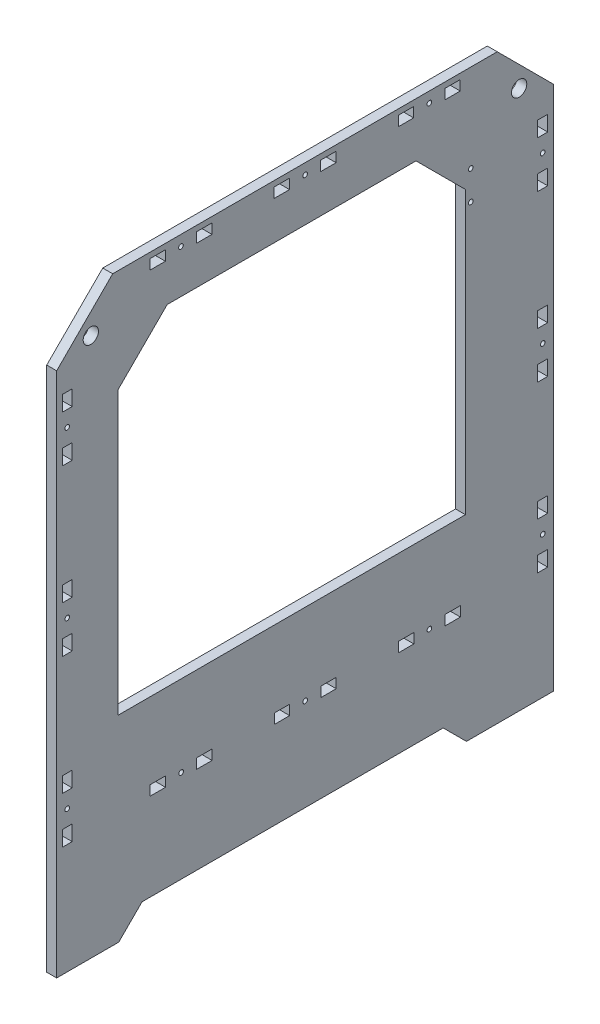
from build123d import *

# Parameters (mm, degrees)
SKETCH1_R           = 1.5
SKETCH1_R_2         = 4.925
SKETCH1_W           = 9.9
SKETCH1_H           = 6.4
SKETCH1_W_2         = 6.4
SKETCH1_H_2         = 9.4
BOSS_EXTRUDE1_DEPTH = 6.4
SKETCH2_R           = 1.5
SKETCH2_W           = 6.4
SKETCH2_H           = 9.9
CUT_EXTRUDE1_DEPTH  = 415.760486883


with BuildPart() as part:
    # Sketch1 → Boss-Extrude1 (new body)
    with BuildSketch(Plane(origin=(0, 0, 0), x_dir=(0, 0, -1), z_dir=(1, 0, 0))):
        Polygon((210.165001125, 41.275232149), (-37.634998875, 41.275232149), (-73.734998875, 5.175232149), (-73.734998875, -333.674767851), (-33.721689147, -333.674767851), (-18.721689147, -318.674767851), (175.325001125, -318.674767851), (190.325001125, -333.674767851), (246.265001125, -333.674767851), (246.265001125, 5.175232149), align=None)
        with Locations((6.365001125, 34.475232149)):
            Circle(SKETCH1_R, mode=Mode.SUBTRACT)
        with Locations((86.365001125, 34.475232149)):
            Circle(SKETCH1_R, mode=Mode.SUBTRACT)
        with Locations((166.365001125, 34.475232149)):
            Circle(SKETCH1_R, mode=Mode.SUBTRACT)
        with Locations((86.46500109, -259.124767851)):
            Circle(SKETCH1_R, mode=Mode.SUBTRACT)
        with Locations((166.465001125, -259.124767851)):
            Circle(SKETCH1_R, mode=Mode.SUBTRACT)
        with Locations((6.46500109, -259.124767851)):
            Circle(SKETCH1_R, mode=Mode.SUBTRACT)
        with Locations((239.465001125, -29.824767851)):
            Circle(SKETCH1_R, mode=Mode.SUBTRACT)
        with Locations((239.465001125, -136.224767851)):
            Circle(SKETCH1_R, mode=Mode.SUBTRACT)
        with Locations((239.465001125, -242.624767851)):
            Circle(SKETCH1_R, mode=Mode.SUBTRACT)
        with Locations((-66.934998875, -242.624767851)):
            Circle(SKETCH1_R, mode=Mode.SUBTRACT)
        with Locations((-66.934998875, -136.224767851)):
            Circle(SKETCH1_R, mode=Mode.SUBTRACT)
        with Locations((-66.934998875, -29.824767851)):
            Circle(SKETCH1_R, mode=Mode.SUBTRACT)
        with Locations((224.265001125, 13.800232149)):
            Circle(SKETCH1_R_2, mode=Mode.SUBTRACT)
        with Locations((-51.734998875, 13.800232149)):
            Circle(SKETCH1_R_2, mode=Mode.SUBTRACT)
        with Locations((193.115001125, -15.324767851)):
            Circle(SKETCH1_R, mode=Mode.SUBTRACT)
        with Locations((193.115001125, -34.074767851)):
            Circle(SKETCH1_R, mode=Mode.SUBTRACT)
        with Locations((151.365001054, 34.475232149)):
            Rectangle(SKETCH1_W, SKETCH1_H, mode=Mode.SUBTRACT)
        with Locations((181.365001197, 34.475232149)):
            Rectangle(SKETCH1_W, SKETCH1_H, mode=Mode.SUBTRACT)
        with Locations((71.365001054, 34.475232149)):
            Rectangle(SKETCH1_W, SKETCH1_H, mode=Mode.SUBTRACT)
        with Locations((101.365001197, 34.475232149)):
            Rectangle(SKETCH1_W, SKETCH1_H, mode=Mode.SUBTRACT)
        with Locations((21.465001197, -259.124767851)):
            Rectangle(SKETCH1_W, SKETCH1_H, mode=Mode.SUBTRACT)
        Polygon((157.825001125, 6.525232149), (189.675001125, -25.324767851), (189.675001125, -206.824767851), (-34.371689147, -206.824767851), (-34.371689147, -25.324767851), (-2.521689147, 6.525232149), align=None, mode=Mode.SUBTRACT)
        Polygon((-3.584998946, -255.924767851), (-3.584999089, -262.324767851), (-13.484999089, -262.324767851), (-13.484998946, -255.924767851), align=None, mode=Mode.SUBTRACT)
        with Locations((101.465001197, -259.124767851)):
            Rectangle(SKETCH1_W, SKETCH1_H, mode=Mode.SUBTRACT)
        with Locations((-8.634998946, 34.475232149)):
            Rectangle(SKETCH1_W, SKETCH1_H, mode=Mode.SUBTRACT)
        with Locations((21.365001197, 34.475232149)):
            Rectangle(SKETCH1_W, SKETCH1_H, mode=Mode.SUBTRACT)
        Polygon((76.415001054, -255.924767851), (76.415000911, -262.324767851), (66.515000911, -262.324767851), (66.515001054, -255.924767851), align=None, mode=Mode.SUBTRACT)
        with Locations((239.465001125, -44.824767851)):
            Rectangle(SKETCH1_W_2, SKETCH1_H_2, mode=Mode.SUBTRACT)
        with Locations((151.465001125, -259.124767851)):
            Rectangle(SKETCH1_W, SKETCH1_H, mode=Mode.SUBTRACT)
        with Locations((181.465001125, -259.124767851)):
            Rectangle(SKETCH1_W, SKETCH1_H, mode=Mode.SUBTRACT)
    extrude(amount=BOSS_EXTRUDE1_DEPTH)

    # Sketch2 → Cut-Extrude1 (cut, through all)
    with BuildSketch(Plane(origin=(6.4, 0, 0), x_dir=(0, 0, -1), z_dir=(1, 0, 0))):
        with Locations((-66.934998875, -242.624767851)):
            Circle(SKETCH2_R)
        with Locations((-66.934998875, -136.224767851)):
            Circle(SKETCH2_R)
        with Locations((-66.934998875, -29.824767851)):
            Circle(SKETCH2_R)
        with Locations((239.465001125, -136.224767851)):
            Circle(SKETCH2_R)
        with Locations((239.465001125, -242.624767851)):
            Circle(SKETCH2_R)
        with Locations((239.465001125, -29.824767851)):
            Circle(SKETCH2_R)
        with Locations((-66.934998875, -257.624767851)):
            Rectangle(SKETCH2_W, SKETCH2_H)
        with Locations((-66.934998875, -227.624767851)):
            Rectangle(SKETCH2_W, SKETCH2_H)
        with Locations((-66.934998875, -121.224767851)):
            Rectangle(SKETCH2_W, SKETCH2_H)
        with Locations((-66.934998875, -151.224767851)):
            Rectangle(SKETCH2_W, SKETCH2_H)
        with Locations((-66.934998875, -14.824767851)):
            Rectangle(SKETCH2_W, SKETCH2_H)
        with Locations((-66.934998875, -44.824767851)):
            Rectangle(SKETCH2_W, SKETCH2_H)
        with Locations((239.465001125, -121.224767851)):
            Rectangle(SKETCH2_W, SKETCH2_H)
        with Locations((239.465001125, -151.224767851)):
            Rectangle(SKETCH2_W, SKETCH2_H)
        with Locations((239.465001125, -227.624767851)):
            Rectangle(SKETCH2_W, SKETCH2_H)
        with Locations((239.465001125, -257.624767851)):
            Rectangle(SKETCH2_W, SKETCH2_H)
        with Locations((239.465001125, -14.824767851)):
            Rectangle(SKETCH2_W, SKETCH2_H)
        with Locations((239.465001125, -44.824767851)):
            Rectangle(SKETCH2_W, SKETCH2_H)
    extrude(amount=-CUT_EXTRUDE1_DEPTH, mode=Mode.SUBTRACT)


solid = part.part
